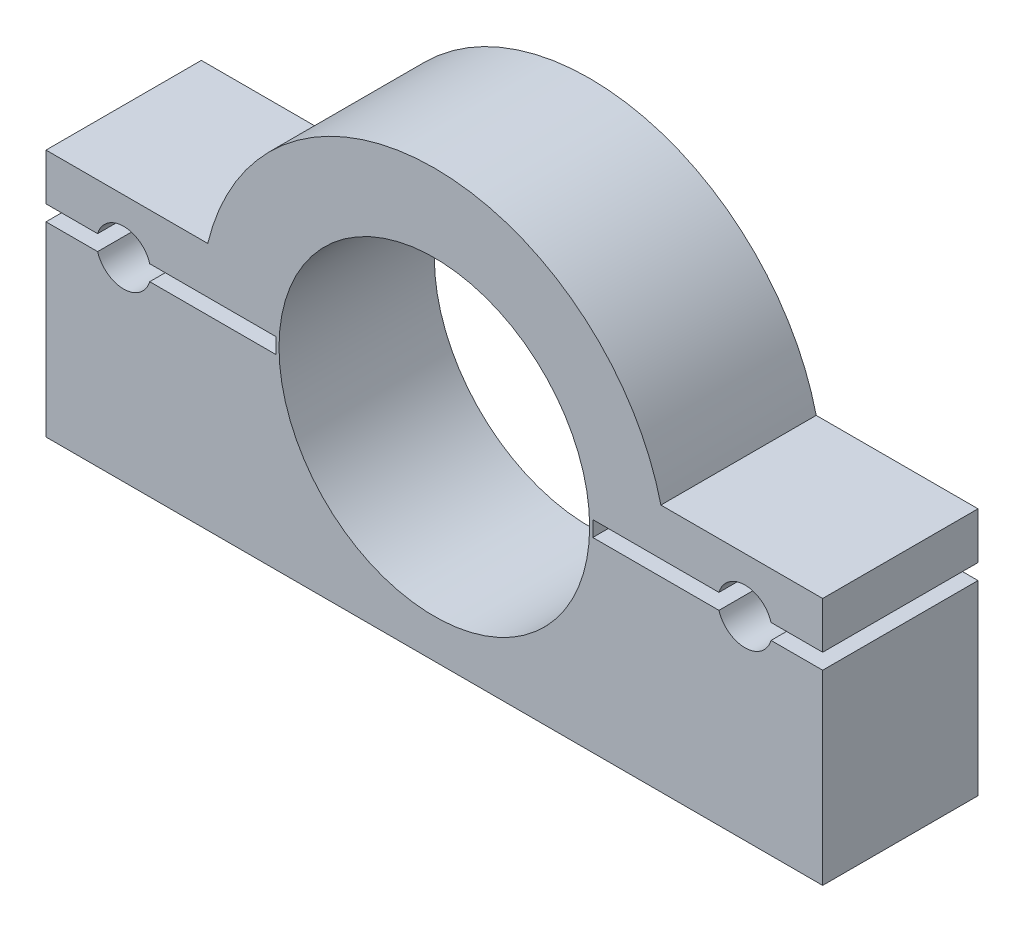
from build123d import *

# Parameters (mm, degrees)
SKETCH_6_R          = 20
EXTRUDE_6_DEPTH     = 20
SKETCH_8_W          = 30.6
SKETCH_8_H          = 2
CUT_EXTRUDE_2_DEPTH = 101
SKETCH_9_R          = 3.5
CUT_EXTRUDE_3_DEPTH = 77.97401861


with BuildPart() as part:
    # 草图6 → 凸台-拉伸6 (new body)
    with BuildSketch(Plane.XY.offset(-10)):
        with BuildLine():
            Line((-50, 0), (50, 0))
            Line((50, 0), (50, 32))
            Line((50, 32), (29.1719, 32))
            ThreePointArc((29.1719, 32), (0, 54.999995827), (-29.1719, 32))
            Line((-29.1719, 32), (-50, 32))
            Line((-50, 32), (-50, 0))
        make_face()
        with Locations((0, 25)):
            Circle(SKETCH_6_R, mode=Mode.SUBTRACT)
    extrude(amount=EXTRUDE_6_DEPTH)

    # 草图8 → 切除-拉伸2 (cut, symmetric)
    with BuildSketch(Plane.XY.offset(-10)):
        with Locations((35.7, 25)):
            Rectangle(SKETCH_8_W, SKETCH_8_H)
        with Locations((-35.7, 25)):
            Rectangle(SKETCH_8_W, SKETCH_8_H)
    extrude(amount=CUT_EXTRUDE_2_DEPTH, both=True, mode=Mode.SUBTRACT)

    # 草图9 → 切除-拉伸3 (cut, through all)
    with BuildSketch(Plane.XY.offset(-10)):
        with Locations((-40, 25)):
            Circle(SKETCH_9_R)
        with Locations((40, 25)):
            Circle(SKETCH_9_R)
    extrude(amount=CUT_EXTRUDE_3_DEPTH, mode=Mode.SUBTRACT)


solid = part.part
